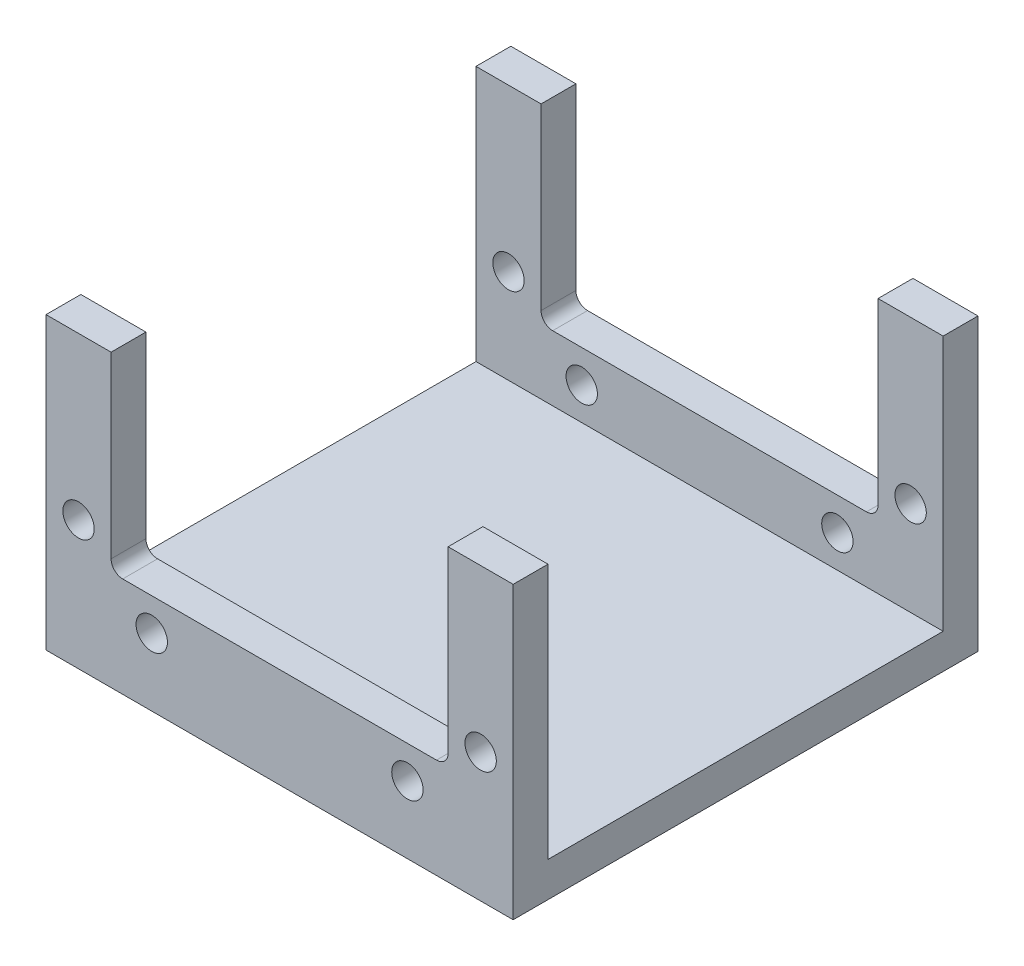
from build123d import *

# Parameters (mm, degrees)
BOSS_EXTRUDE1_DEPTH     = 40.2
CUT_EXTRUDE1_DEPTH      = 62.976124435
CUT_EXTRUDE1_DEPTH_BACK = 62.976124435
CUT_EXTRUDE2_DEPTH      = 61.083608414
CUT_EXTRUDE2_DEPTH_BACK = 61.083608414
SKETCH3_R               = 1.35


with BuildPart() as part:
    # Sketch1 → Boss-Extrude1 (new body)
    with BuildSketch(Plane(origin=(0, 0, 0), x_dir=(0, 0, -1), z_dir=(1, 0, 0))):
        Polygon((0, 25), (0, 0), (40, 0), (40, 25), (37, 25), (37, 3), (3, 3), (3, 25), align=None)
    extrude(amount=BOSS_EXTRUDE1_DEPTH)

    # Sketch2 → Cut-Extrude1 (cut, two sides: drawn at the far end of the back side and taken through both)
    with BuildSketch(Plane.XY.offset(-CUT_EXTRUDE1_DEPTH_BACK)):
        with BuildLine():
            Line((20.1, 8.6), (20.1, 25))
            Line((20.1, 25), (5.6, 25))
            Line((5.6, 25), (5.6, 9.6))
            ThreePointArc((5.6, 9.6), (5.892893219, 8.892893219), (6.6, 8.6))
            Line((6.6, 8.6), (20.1, 8.6))
        make_face()
        with BuildLine():
            Line((34.6, 25), (20.1, 25))
            Line((20.1, 25), (20.1, 8.6))
            Line((20.1, 8.6), (33.6, 8.6))
            ThreePointArc((33.6, 8.6), (34.307106781, 8.892893219), (34.6, 9.6))
            Line((34.6, 9.6), (34.6, 25))
        make_face()
    extrude(amount=CUT_EXTRUDE1_DEPTH + CUT_EXTRUDE1_DEPTH_BACK, mode=Mode.SUBTRACT)

    # Sketch3 → Cut-Extrude2 (cut, two sides: drawn at the far end of the back side and taken through both)
    with BuildSketch(Plane(origin=(0, 0, -3), x_dir=(-1, 0, 0), z_dir=(0, 0, -1)).offset(-CUT_EXTRUDE2_DEPTH_BACK)):
        with Locations((-9.1, 5.8)):
            Circle(SKETCH3_R)
        with Locations((-2.8, 11.1)):
            Circle(SKETCH3_R)
        with Locations((-37.4, 11.1)):
            Circle(SKETCH3_R)
        with Locations((-31.1, 5.8)):
            Circle(SKETCH3_R)
    extrude(amount=CUT_EXTRUDE2_DEPTH + CUT_EXTRUDE2_DEPTH_BACK, mode=Mode.SUBTRACT)


solid = part.part
